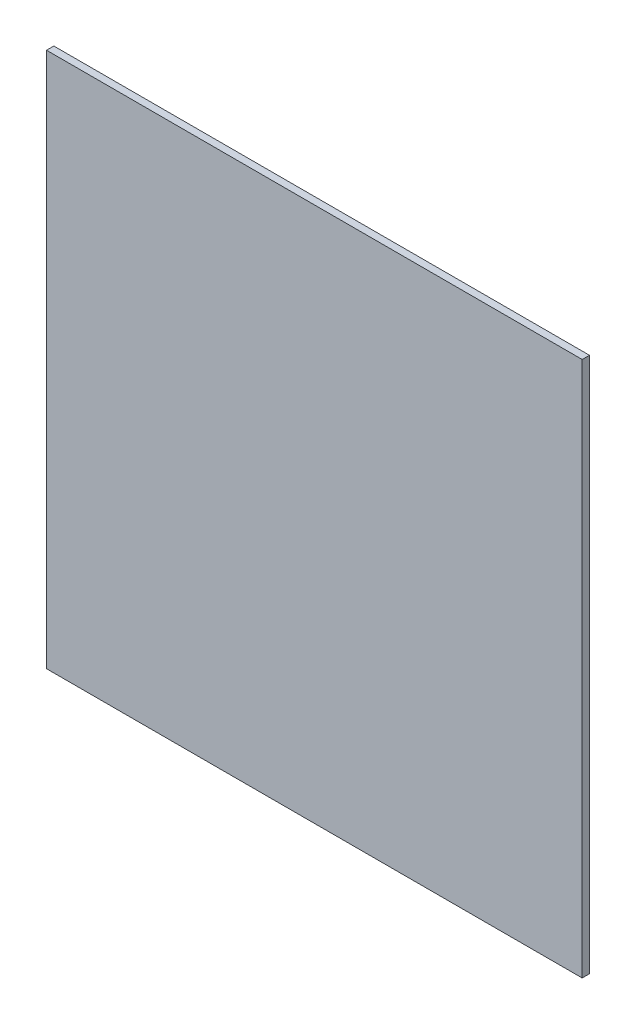
from build123d import *

# Parameters (mm, degrees)
SKETCH_1_W      = 220
SKETCH_1_H      = 220
EXTRUDE_1_DEPTH = 3


with BuildPart() as part:
    # Эскиз1 → Бобышка-Вытянуть1 (new body)
    with BuildSketch(Plane.XY):
        Rectangle(SKETCH_1_W, SKETCH_1_H)
    extrude(amount=EXTRUDE_1_DEPTH)


solid = part.part
